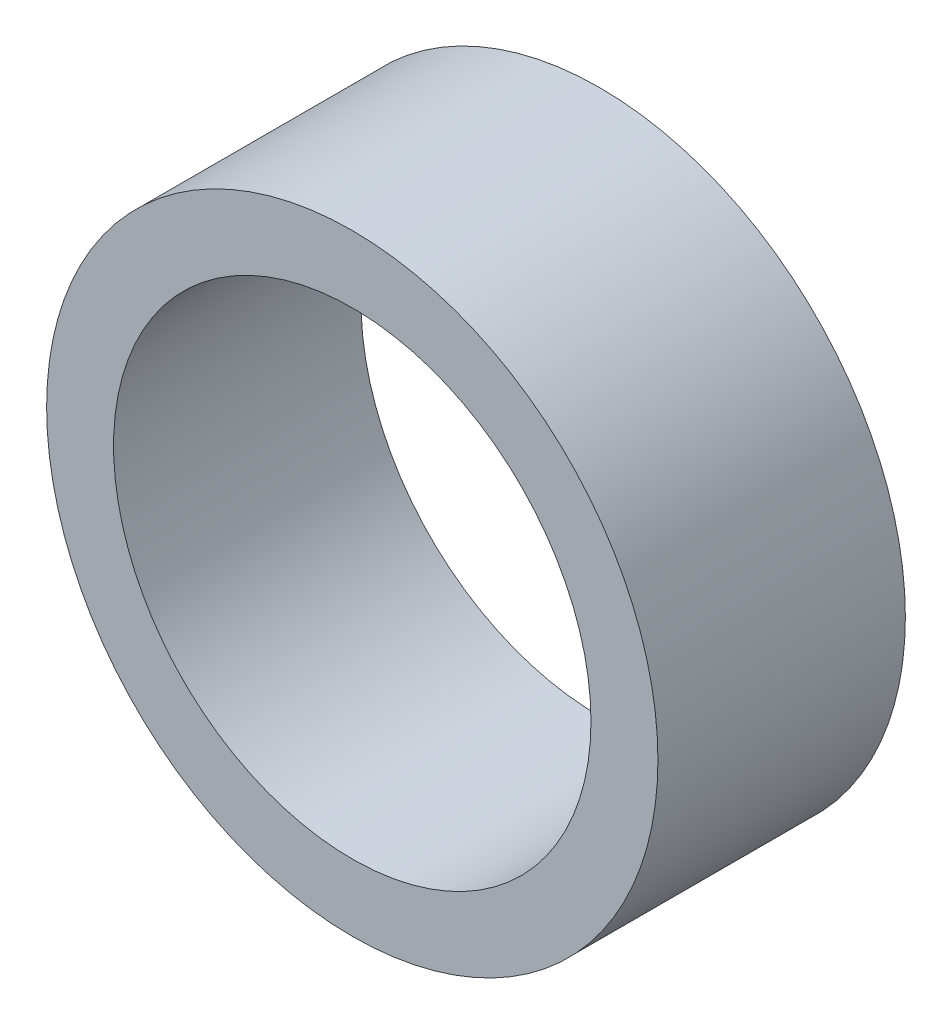
from build123d import *

# Parameters (mm, degrees)
SKETCH1_R           = 10.5
SKETCH1_R_2         = 8.2
BOSS_EXTRUDE1_DEPTH = 8.5


with BuildPart() as part:
    # Sketch1 → Boss-Extrude1 (new body)
    with BuildSketch(Plane.XY):
        Circle(SKETCH1_R)
        Circle(SKETCH1_R_2, mode=Mode.SUBTRACT)
    extrude(amount=BOSS_EXTRUDE1_DEPTH)


solid = part.part
